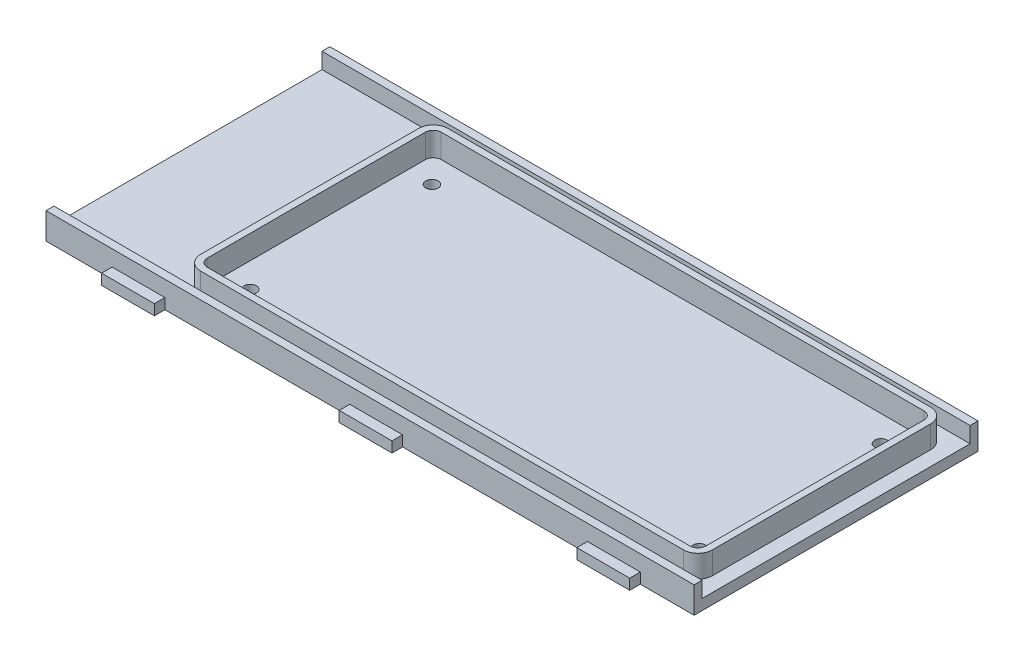
from build123d import *

# Parameters (mm, degrees)
BOSS_EXTRUDE1_DEPTH = 2
SKETCH2_W           = 122.7
SKETCH2_H           = 1.5
BOSS_EXTRUDE2_DEPTH = 3
CUT_EXTRUDE1_DEPTH  = 0.25
BOSS_EXTRUDE3_START = 4.25
BOSS_EXTRUDE3_DEPTH = 4.25
SKETCH5_R           = 1.175
CUT_EXTRUDE2_DEPTH  = 68.954676991


with BuildPart() as part:
    # Sketch1 → Boss-Extrude1 (new body)
    with BuildSketch(Plane(origin=(0, 0, 0), x_dir=(1, 0, 0), z_dir=(0, 1, 0))):
        Polygon((-61.35, 26.875), (-48.84, 26.875), (-48.84, 28.875), (-38.84, 28.875), (-38.84, 26.875), (-3.84, 26.875), (-3.84, 28.875), (6.16, 28.875), (6.16, 26.875), (41.16, 26.875), (41.16, 28.875), (51.16, 28.875), (51.16, 26.875), (61.35, 26.875), (61.35, -26.875), (51.16, -26.875), (51.16, -28.875), (41.16, -28.875), (41.16, -26.875), (6.16, -26.875), (6.16, -28.875), (-3.84, -28.875), (-3.84, -26.875), (-38.84, -26.875), (-38.84, -28.875), (-48.84, -28.875), (-48.84, -26.875), (-61.35, -26.875), align=None)
    extrude(amount=BOSS_EXTRUDE1_DEPTH)

    # Sketch2 → Boss-Extrude2 (add)
    with BuildSketch(Plane(origin=(0, 2, 0), x_dir=(1, 0, 0), z_dir=(0, 1, 0))):
        with Locations((0, 26.125)):
            Rectangle(SKETCH2_W, SKETCH2_H)
        with Locations((0, -26.125)):
            Rectangle(SKETCH2_W, SKETCH2_H)
    extrude(amount=BOSS_EXTRUDE2_DEPTH)

    # Sketch3 → Cut-Extrude1 (cut)
    with BuildSketch(Plane(origin=(0, 2, 0), x_dir=(1, 0, 0), z_dir=(0, 1, 0))):
        with BuildLine():
            Line((-35.55, 22.15), (55.85, 22.15))
            ThreePointArc((55.85, 22.15), (56.910660172, 21.710660172), (57.35, 20.65))
            Line((57.35, 20.65), (57.35, -20.65))
            ThreePointArc((57.35, -20.65), (56.910660172, -21.710660172), (55.85, -22.15))
            Line((55.85, -22.15), (-35.55, -22.15))
            ThreePointArc((-35.55, -22.15), (-36.610660172, -21.710660172), (-37.05, -20.65))
            Line((-37.05, -20.65), (-37.05, 20.65))
            ThreePointArc((-37.05, 20.65), (-36.610660172, 21.710660172), (-35.55, 22.15))
        make_face()
    extrude(amount=-CUT_EXTRUDE1_DEPTH, mode=Mode.SUBTRACT)

    # Sketch4 → Boss-Extrude3 (add)
    with BuildSketch(Plane(origin=(0, 2, 0), x_dir=(1, 0, 0), z_dir=(0, 1, 0)).offset(BOSS_EXTRUDE3_START)):
        with BuildLine():
            Line((55.85, 23.4), (-35.55, 23.4))
            ThreePointArc((-35.55, 23.4), (-37.494543648, 22.594543648), (-38.3, 20.65))
            Line((-38.3, 20.65), (-38.3, -20.65))
            ThreePointArc((-38.3, -20.65), (-37.494543648, -22.594543648), (-35.55, -23.4))
            Line((-35.55, -23.4), (55.85, -23.4))
            ThreePointArc((55.85, -23.4), (57.794543648, -22.594543648), (58.6, -20.65))
            Line((58.6, -20.65), (58.6, 20.65))
            ThreePointArc((58.6, 20.65), (57.794543648, 22.594543648), (55.85, 23.4))
        make_face()
        with BuildLine():
            Line((55.85, 22.15), (-35.55, 22.15))
            ThreePointArc((-35.55, 22.15), (-36.610660172, 21.710660172), (-37.05, 20.65))
            Line((-37.05, 20.65), (-37.05, -20.65))
            ThreePointArc((-37.05, -20.65), (-36.610660172, -21.710660172), (-35.55, -22.15))
            Line((-35.55, -22.15), (55.85, -22.15))
            ThreePointArc((55.85, -22.15), (56.910660172, -21.710660172), (57.35, -20.65))
            Line((57.35, -20.65), (57.35, 20.65))
            ThreePointArc((57.35, 20.65), (56.910660172, 21.710660172), (55.85, 22.15))
        make_face(mode=Mode.SUBTRACT)
    extrude(amount=-BOSS_EXTRUDE3_DEPTH)

    # Sketch5 → Cut-Extrude2 (cut, through all)
    with BuildSketch(Plane(origin=(0, 1.75, 0), x_dir=(1, 0, 0), z_dir=(0, 1, 0))):
        with Locations(Location((-32.35, 17.2, 0), (0, 0, 270))):
            Circle(SKETCH5_R)
        with Locations(Location((52.65, 17.2, 0), (0, 0, 270))):
            Circle(SKETCH5_R)
        with Locations(Location((52.65, -17.2, 0), (0, 0, 270))):
            Circle(SKETCH5_R)
        with Locations(Location((-32.35, -17.2, 0), (0, 0, 270))):
            Circle(SKETCH5_R)
    extrude(amount=-CUT_EXTRUDE2_DEPTH, mode=Mode.SUBTRACT)


solid = part.part
